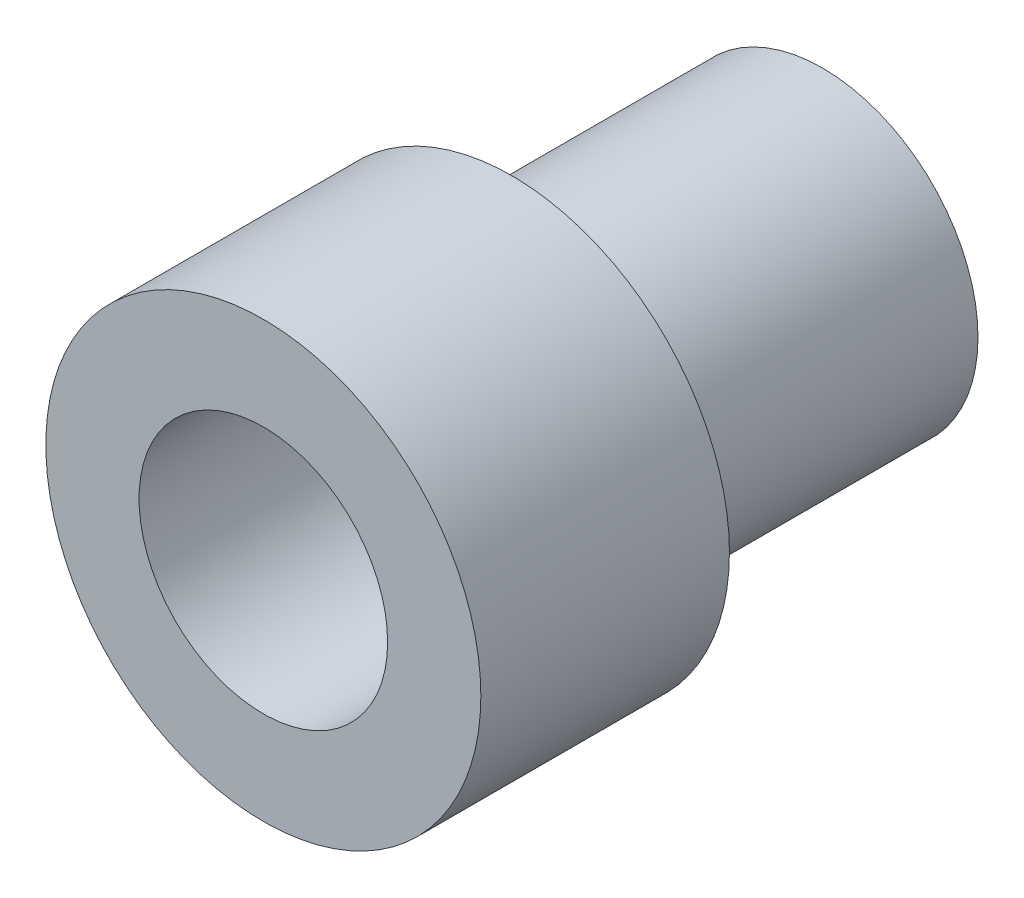
from build123d import *

# Parameters (mm, degrees)
SKETCH1_R      = 2.5
SKETCH1_R_2    = 1.5
EXTRUDE1_DEPTH = 5
SKETCH2_R      = 3.5
SKETCH2_R_2    = 2
EXTRUDE2_DEPTH = 4


with BuildPart() as part:
    # Sketch1 → Extrude1 (new body)
    with BuildSketch(Plane.XY):
        Circle(SKETCH1_R)
        Circle(SKETCH1_R_2, mode=Mode.SUBTRACT)
    extrude(amount=EXTRUDE1_DEPTH)

    # Sketch2 → Extrude2 (add)
    with BuildSketch(Plane.XY.offset(5)):
        Circle(SKETCH2_R)
        Circle(SKETCH2_R_2, mode=Mode.SUBTRACT)
    extrude(amount=EXTRUDE2_DEPTH)


solid = part.part
